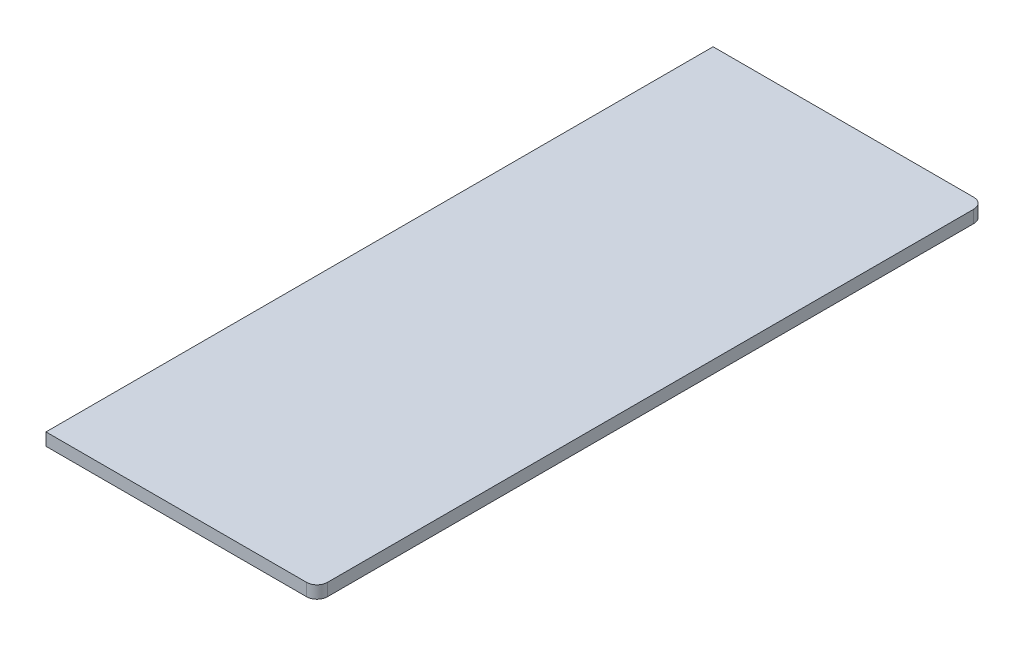
from build123d import *

# Parameters (mm, degrees)
SKETCH1_W           = 130
SKETCH1_H           = 320
BOSS_EXTRUDE1_DEPTH = 6
FILLET1_R           = 5


with BuildPart() as part:
    # Sketch1 → Boss-Extrude1 (new body)
    with BuildSketch(Plane(origin=(0, 0, 0), x_dir=(1, 0, 0), z_dir=(0, 1, 0))):
        with Locations((65, -160)):
            Rectangle(SKETCH1_W, SKETCH1_H)
    extrude(amount=BOSS_EXTRUDE1_DEPTH)

    # Fillet1
    fillet1_edges = [part.edges().sort_by_distance(p)[0] for p in [
        (130, 3, 0),
        (130, 3, 320),
    ]]
    fillet(fillet1_edges, radius=FILLET1_R)


solid = part.part
